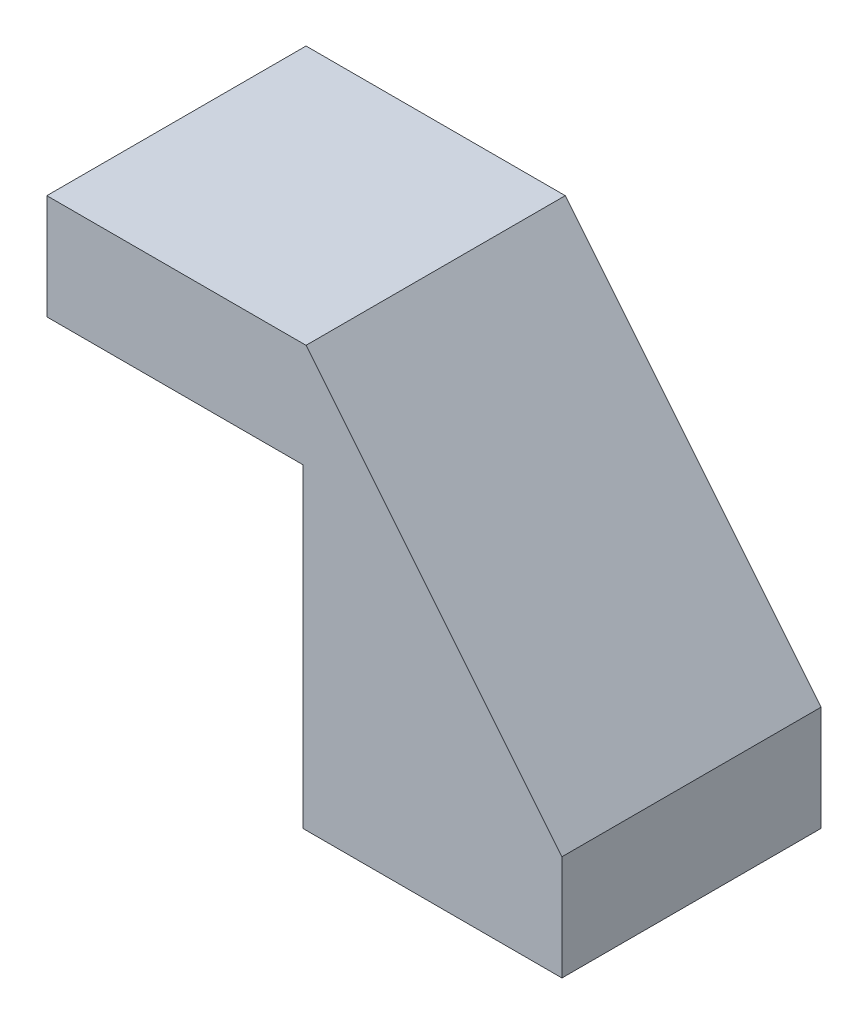
from build123d import *

# Parameters (mm, degrees)
SKETCH1_W           = 7.9
SKETCH1_H           = 7.9
BOSS_EXTRUDE1_DEPTH = 3.2
SKETCH2_W           = 7.9
SKETCH2_H           = 9.6
BOSS_EXTRUDE2_DEPTH = 0.1
SKETCH3_W           = 7.9
SKETCH3_H           = 7.9
BOSS_EXTRUDE3_DEPTH = 3.2
BOSS_EXTRUDE4_DEPTH = 7.9


with BuildPart() as part:
    # Sketch1 → Boss-Extrude1 (new body)
    with BuildSketch(Plane(origin=(0, 0, 0), x_dir=(1, 0, 0), z_dir=(0, 1, 0))):
        with Locations((3.95, 3.95)):
            Rectangle(SKETCH1_W, SKETCH1_H)
    extrude(amount=BOSS_EXTRUDE1_DEPTH)

    # Sketch2 → Boss-Extrude2 (add)
    with BuildSketch(Plane.ZY):
        with Locations((-3.95, 4.8)):
            Rectangle(SKETCH2_W, SKETCH2_H)
    extrude(amount=-BOSS_EXTRUDE2_DEPTH)

    # Sketch3 → Boss-Extrude3 (add)
    with BuildSketch(Plane(origin=(0, 9.6, 0), x_dir=(1, 0, 0), z_dir=(0, 1, 0))):
        with Locations((-3.85, 3.95)):
            Rectangle(SKETCH3_W, SKETCH3_H)
    extrude(amount=BOSS_EXTRUDE3_DEPTH)

    # Sketch4 → Boss-Extrude4 (add)
    with BuildSketch(Plane.XY):
        Polygon((0.1, 12.8), (7.9, 3.2), (0.1, 3.2), align=None)
    extrude(amount=-BOSS_EXTRUDE4_DEPTH)


solid = part.part
